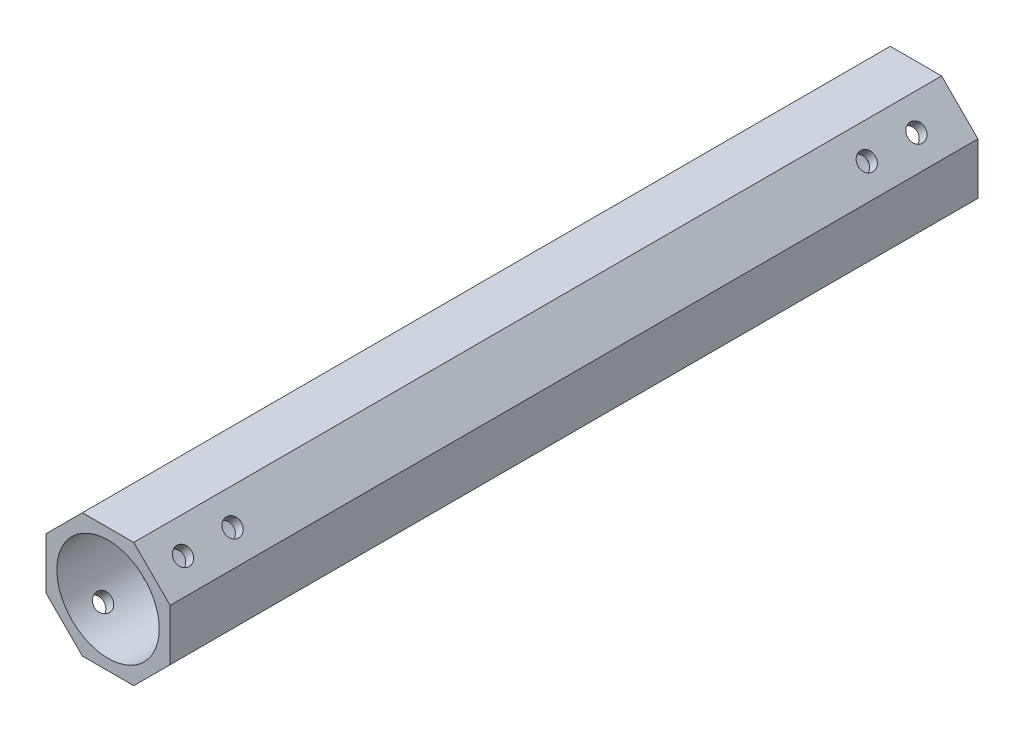
from build123d import *

# Parameters (mm, degrees)
SKETCH1_R           = 8.25
BOSS_EXTRUDE1_DEPTH = 128.2
BOSS_EXTRUDE2_DEPTH = 2
SKETCH6_R           = 1.4
CUT_EXTRUDE2_DEPTH  = 133.419344178
CIRPATTERN1_COUNT   = 2
CIRPATTERN1_ANGLE   = 270
SKETCH7_R           = 6.269832862
CUT_EXTRUDE3_DEPTH  = 131.965797161


with BuildPart() as part:
    # Sketch1 → Boss-Extrude1 (new body)
    with BuildSketch(Plane.XY):
        Polygon((10, 4.142135624), (4.142135624, 10), (-4.142135624, 10), (-10, 4.142135624), (-10, -4.142135624), (-4.142135624, -10), (4.142135624, -10), (10, -4.142135624), align=None)
        Circle(SKETCH1_R, mode=Mode.SUBTRACT)
    extrude(amount=-BOSS_EXTRUDE1_DEPTH)

    # Sketch2 → Boss-Extrude2 (add)
    with BuildSketch(Plane(origin=(0, 0, -128.2), x_dir=(-1, 0, 0), z_dir=(0, 0, -1))):
        Polygon((-10, 4.142135624), (-10, -4.142135624), (-4.142135624, -10), (4.142135624, -10), (10, -4.142135624), (10, 4.142135624), (4.142135624, 10), (-4.142135624, 10), align=None)
    extrude(amount=BOSS_EXTRUDE2_DEPTH)

    # Sketch6 → Cut-Extrude2 (cut, through all)
    with BuildSketch(Plane(origin=(-7.071067812, 7.071067812, 0), x_dir=(0, 0, 1), z_dir=(-0.7071067811865476, 0.7071067811865476, 0))):
        with Locations(Location((-13, 0, 0), (0, 0, 270))):
            Circle(SKETCH6_R)
        with Locations(Location((-5, 0, 0), (0, 0, 270))):
            Circle(SKETCH6_R)
        with Locations(Location((-115.2, 0, 0), (0, 0, 270))):
            Circle(SKETCH6_R)
        with Locations(Location((-123.2, 0, 0), (0, 0, 270))):
            Circle(SKETCH6_R)
    cut_extrude2 = extrude(amount=-CUT_EXTRUDE2_DEPTH, mode=Mode.SUBTRACT)

    # CirPattern1: Cut-Extrude2 ×2 about axis
    cirpattern1_axis = Axis((0, 0, 6.85), (0, 0, -1))
    for i in range(1, CIRPATTERN1_COUNT):
        add(cut_extrude2.rotate(cirpattern1_axis, i * CIRPATTERN1_ANGLE / (CIRPATTERN1_COUNT - 1)), mode=Mode.SUBTRACT)

    # Sketch7 → Cut-Extrude3 (cut, through all)
    with BuildSketch(Plane(origin=(0, 0, -130.2), x_dir=(-1, 0, 0), z_dir=(0, 0, -1))):
        Circle(SKETCH7_R)
    extrude(amount=-CUT_EXTRUDE3_DEPTH, mode=Mode.SUBTRACT)


solid = part.part
